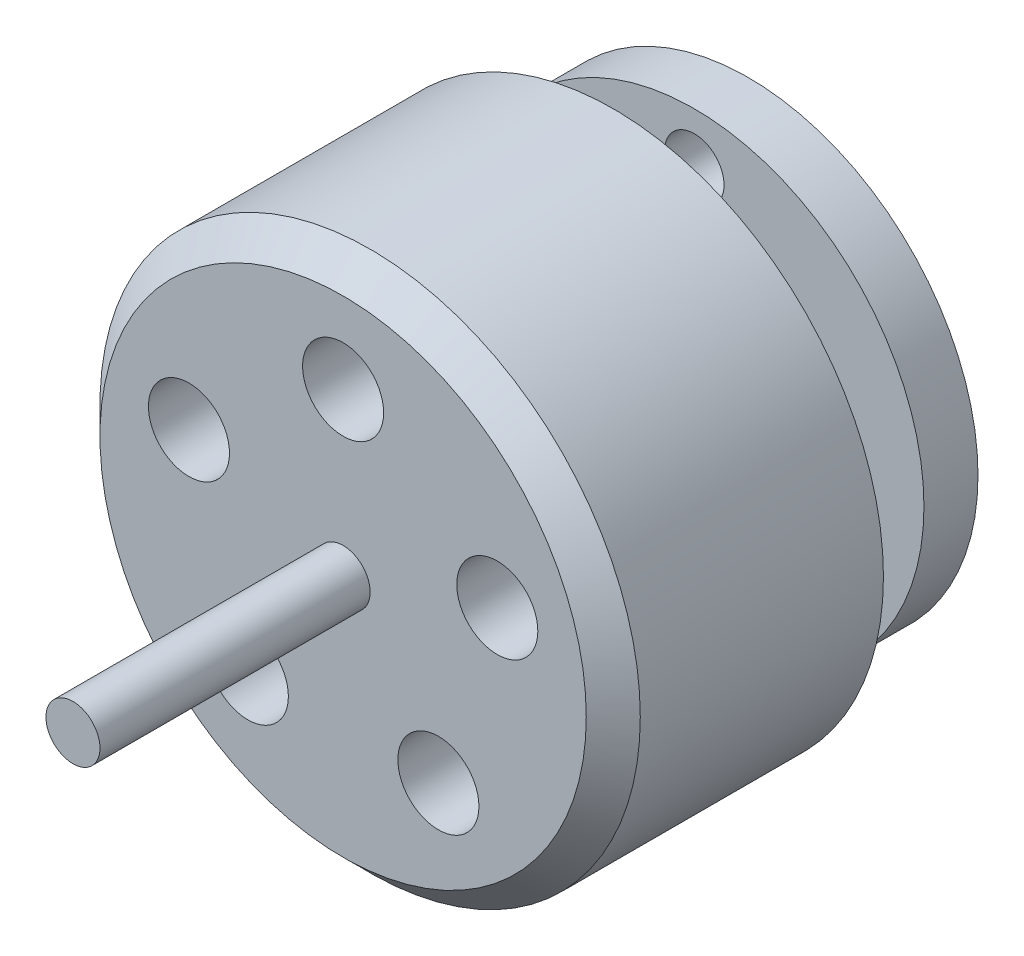
from build123d import *

# Parameters (mm, degrees)
SKETCH1_R           = 4.25
SKETCH1_R_2         = 0.55
BOSS_EXTRUDE1_DEPTH = 1
SKETCH2_R           = 1.5
BOSS_EXTRUDE2_DEPTH = 1.5
SKETCH3_R           = 5
BOSS_EXTRUDE3_DEPTH = 5
SKETCH4_R           = 0.5
BOSS_EXTRUDE4_DEPTH = 5
SKETCH5_R           = 0.75
CUT_EXTRUDE1_DEPTH  = 2
CHAMFER1_SIZE       = 0.5


with BuildPart() as part:
    # Sketch1 → Boss-Extrude1 (new body)
    with BuildSketch(Plane.XY):
        Circle(SKETCH1_R)
        with Locations((0, 3.3)):
            Circle(SKETCH1_R_2, mode=Mode.SUBTRACT)
        with Locations((2.857883832, -1.65)):
            Circle(SKETCH1_R_2, mode=Mode.SUBTRACT)
        with Locations((-2.857883832, -1.65)):
            Circle(SKETCH1_R_2, mode=Mode.SUBTRACT)
    extrude(amount=BOSS_EXTRUDE1_DEPTH)

    # Sketch2 → Boss-Extrude2 (add)
    with BuildSketch(Plane.XY.offset(1)):
        Circle(SKETCH2_R)
    extrude(amount=BOSS_EXTRUDE2_DEPTH)

    # Sketch3 → Boss-Extrude3 (add)
    with BuildSketch(Plane.XY.offset(2.5)):
        Circle(SKETCH3_R)
    extrude(amount=BOSS_EXTRUDE3_DEPTH)

    # Sketch4 → Boss-Extrude4 (add)
    with BuildSketch(Plane.XY.offset(7.5)):
        Circle(SKETCH4_R)
    extrude(amount=BOSS_EXTRUDE4_DEPTH)

    # Sketch5 → Cut-Extrude1 (cut)
    with BuildSketch(Plane.XY.offset(7.5)):
        with Locations((0, 3)):
            Circle(SKETCH5_R)
        with Locations((2.853169549, 0.927050983)):
            Circle(SKETCH5_R)
        with Locations((1.763355757, -2.427050983)):
            Circle(SKETCH5_R)
        with Locations((-1.763355757, -2.427050983)):
            Circle(SKETCH5_R)
        with Locations((-2.853169549, 0.927050983)):
            Circle(SKETCH5_R)
    extrude(amount=-CUT_EXTRUDE1_DEPTH, mode=Mode.SUBTRACT)

    # Chamfer1
    chamfer1_edges = [part.edges().sort_by_distance(p)[0] for p in [
        (-5, 0, 7.5),
    ]]
    chamfer(chamfer1_edges, length=CHAMFER1_SIZE)


solid = part.part
